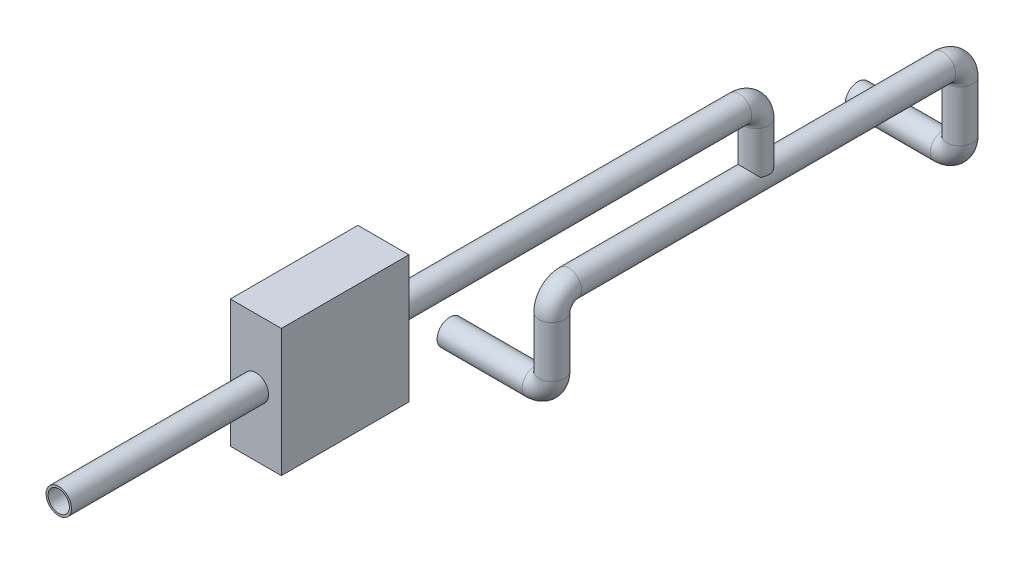
from build123d import *

# Parameters (mm, degrees)
SWEEP1_PROFILE_R     = 7.5
SWEEP2_PROFILE_R     = 7.5
CUT_SWEEP1_PROFILE_R = 6.25
CUT_SWEEP2_PROFILE_R = 6.25
SKETCH35_W           = 75
SKETCH35_H           = 75
BOSS_EXTRUDE1_DEPTH  = 15
BOSS_EXTRUDE2_DEPTH  = 1


with BuildPart() as part:
    # Sweep1: sweep along a curve in space
    with BuildLine() as sweep1_path:
        Line((-10, -50, 120), (-60, -50, 120))
        ThreePointArc((-10, -50, 120), (-2.928932188, -47.071067812, 120), (0, -40, 120))
        Line((0, -10, 120), (0, -40, 120))
        ThreePointArc((0, -10, 120), (0, -2.928932188, 117.071067812), (0, 0, 110))
        Line((0, 0, 0), (0, 0, 110))
        Line((0, 0, 0), (0, 0, -110))
        ThreePointArc((0, -10, -120), (0, -2.928932188, -117.071067812), (0, 0, -110))
        Line((0, -10, -120), (0, -40, -120))
        ThreePointArc((0, -40, -120), (-2.928932188, -47.071067812, -120), (-10, -50, -120))
        Line((-10, -50, -120), (-60, -50, -120))
    # Sweep1 profile (on start of the path) → Sweep1 (sweep)
    with BuildSketch(Plane(origin=(-60, -50, -120), x_dir=(0, 0, 1), z_dir=(1, 0, 0))):
        Circle(SWEEP1_PROFILE_R)
    sweep(path=sweep1_path.line)

    # Sweep2: sweep along a path in Sketch30
    with BuildLine(Plane(origin=(0, 0, 0), x_dir=(0, 0, -1), z_dir=(1, 0, 0))) as sweep2_path:
        Line((0, 3.788993713), (0, 28.788993713))
        ThreePointArc((0, 28.788993713), (-2.928932188, 35.860061525), (-10, 38.788993713))
        Line((-10, 38.788993713), (-410, 38.788993713))
    # Sweep2 profile (on start of the path) → Sweep2 (sweep)
    with BuildSketch(Plane.ZX.offset(3.788993713)):
        Circle(SWEEP2_PROFILE_R)
    sweep(path=sweep2_path.line)

    # Cut-Sweep1: sweep along a curve in space
    with BuildLine() as cut_sweep1_path:
        Line((-10, -50, 120), (-60, -50, 120))
        ThreePointArc((-10, -50, 120), (-2.928932188, -47.071067812, 120), (0, -40, 120))
        Line((0, -10, 120), (0, -40, 120))
        ThreePointArc((0, -10, 120), (0, -2.928932188, 117.071067812), (0, 0, 110))
        Line((0, 0, 0), (0, 0, 110))
        Line((0, 0, 0), (0, 0, -110))
        ThreePointArc((0, -10, -120), (0, -2.928932188, -117.071067812), (0, 0, -110))
        Line((0, -10, -120), (0, -40, -120))
        ThreePointArc((0, -40, -120), (-2.928932188, -47.071067812, -120), (-10, -50, -120))
        Line((-10, -50, -120), (-60, -50, -120))
    # Cut-Sweep1 profile (on start of the path) → Cut-Sweep1 (sweep, cut)
    with BuildSketch(Plane(origin=(-60, -50, -120), x_dir=(0, 0, 1), z_dir=(1, 0, 0))):
        Circle(CUT_SWEEP1_PROFILE_R)
    sweep(path=cut_sweep1_path.line, mode=Mode.SUBTRACT)

    # Cut-Sweep2: sweep along a path in Sketch30<2>
    with BuildLine(Plane(origin=(0, 0, 0), x_dir=(0, 0, -1), z_dir=(1, 0, 0))) as cut_sweep2_path:
        Line((0, 3.788993713), (0, 28.788993713))
        ThreePointArc((0, 28.788993713), (-2.928932188, 35.860061525), (-10, 38.788993713))
        Line((-10, 38.788993713), (-410, 38.788993713))
    # Cut-Sweep2 profile (on start of the path) → Cut-Sweep2 (sweep, cut)
    with BuildSketch(Plane.ZX.offset(3.788993713)):
        Circle(CUT_SWEEP2_PROFILE_R)
    sweep(path=cut_sweep2_path.line, mode=Mode.SUBTRACT)

    # Sketch35 → Boss-Extrude1 (add, symmetric)
    with BuildSketch(Plane(origin=(0, 0, 0), x_dir=(0, 0, -1), z_dir=(1, 0, 0))):
        with Locations((-256.605520268, 38.788993713)):
            Rectangle(SKETCH35_W, SKETCH35_H)
    extrude(amount=BOSS_EXTRUDE1_DEPTH, both=True)

    # Sketch48 → Boss-Extrude2 (add)
    # profile 1 of 23: a face of its own
    with BuildSketch(Plane.ZY.offset(15)):
        with BuildLine():
            Line((226.687251037, 53.697327046), (228.1327071, 53.697327046))
            add(Edge.make_bspline(
                [(228.1327071, 53.697327046), (228.203464046, 53.696955041), (228.340608616, 53.696234003), (228.540039768, 53.685051375), (228.726833084, 53.669803607), (228.901042735, 53.645609911), (229.062588222, 53.616417316), (229.211956388, 53.581065139), (229.348672252, 53.538675473), (229.511894211, 53.471267511), (229.697992943, 53.371100138), (229.899496208, 53.223084675), (230.071801848, 53.042040962), (230.220362886, 52.837819341), (230.338475256, 52.613165291), (230.423923602, 52.373433341), (230.478021104, 52.121715654), (230.483584624, 51.948904261), (230.486396337, 51.861568165)],
                knots=[0, 0, 0, 0, 1.001505555, 1.941167018, 2.826882275, 3.653841531, 4.429895133, 5.150066043, 5.825578002, 6.45369114, 7.647487171, 8.808567382, 9.977351308, 11.170798116, 12.373658725, 13.556498008, 14.765093433, 16, 16, 16, 16], degree=3))
            add(Edge.make_bspline(
                [(230.486396337, 51.861568165), (230.484082358, 51.779753589), (230.47953517, 51.618980231), (230.436052997, 51.383831033), (230.367979582, 51.159990953), (230.273353471, 50.948276904), (230.150370912, 50.753472423), (230.004620805, 50.574006043), (229.828774906, 50.417476306), (229.697026715, 50.329967162), (229.630104603, 50.285516482)],
                knots=[0, 0, 0, 0, 1.044552857, 2.05264487, 3.044412934, 4.028983338, 5.005914585, 5.980388656, 6.974128949, 8, 8, 8, 8], degree=3))
            add(Edge.make_bspline(
                [(229.630104603, 50.285516482), (229.714264175, 50.253205568), (229.875282283, 50.191386785), (230.096867676, 50.082091719), (230.287780098, 49.963215252), (230.449487391, 49.833396169), (230.587785427, 49.693465853), (230.708547487, 49.541372528), (230.811589729, 49.375132157), (230.899882083, 49.196478007), (230.96877695, 49.007234316), (231.020372615, 48.809176173), (231.049937049, 48.603013782), (231.054144223, 48.462709729), (231.056268131, 48.391879997)],
                knots=[0, 0, 0, 0, 1.27268992, 2.434971085, 3.483601985, 4.442670788, 5.356604649, 6.2567628, 7.179492994, 8.113709626, 9.066344395, 10.018646069, 10.999752585, 12, 12, 12, 12], degree=3))
            add(Edge.make_bspline(
                [(231.056268131, 48.391879997), (231.054200474, 48.319560118), (231.0501323, 48.177268729), (231.020118026, 47.968237028), (230.96929875, 47.768476724), (230.899298157, 47.576695754), (230.807937924, 47.393265136), (230.696753733, 47.217977061), (230.56418359, 47.052592728), (230.415883851, 46.895274392), (230.24811231, 46.753822242), (230.067103962, 46.62784733), (229.870579251, 46.524244832), (229.661765864, 46.437215919), (229.438321395, 46.370737349), (229.201249209, 46.324228735), (228.95075377, 46.292891406), (228.778859797, 46.290314989), (228.690706566, 46.288993713)],
                knots=[0, 0, 0, 0, 0.978564426, 1.925352924, 2.850884081, 3.763762016, 4.682927383, 5.618979971, 6.567305752, 7.547517671, 8.540179244, 9.531824382, 10.526200242, 11.540722885, 12.589160233, 13.674978461, 14.80764778, 16, 16, 16, 16], degree=3))
            Line((228.690706566, 46.288993713), (226.687251037, 46.288993713))
            Line((226.687251037, 46.288993713), (226.687251037, 53.697327046))
        make_face()
        with BuildLine():
            Line((227.352101465, 52.937497986), (227.352101465, 50.563032174))
            Line((227.352101465, 50.563032174), (227.798797846, 50.563032174))
            add(Edge.make_bspline(
                [(227.798797846, 50.563032174), (227.864094463, 50.563878678), (227.990260833, 50.565514296), (228.172971281, 50.570199573), (228.342569236, 50.583318765), (228.498761949, 50.596434187), (228.641303456, 50.61775873), (228.769877962, 50.643142057), (228.886503326, 50.66998754), (229.020995364, 50.715642954), (229.173549772, 50.783117366), (229.336179842, 50.887832753), (229.479551136, 51.012555967), (229.600618517, 51.156470169), (229.699702796, 51.314936929), (229.768523493, 51.485427826), (229.815190245, 51.663693772), (229.819405653, 51.786075741), (229.821545909, 51.848211795)],
                knots=[0, 0, 0, 0, 1.156816544, 2.235205308, 3.236616184, 4.169592532, 5.011045266, 5.787822928, 6.49130361, 7.128639758, 8.301311294, 9.436451833, 10.541879658, 11.654887649, 12.756523258, 13.837046038, 14.901820046, 16, 16, 16, 16], degree=3))
            add(Edge.make_bspline(
                [(229.821545909, 51.848211795), (229.820432161, 51.889329678), (229.818247423, 51.969986896), (229.800354599, 52.087566362), (229.769943233, 52.198148971), (229.730881646, 52.303250172), (229.676295588, 52.399583588), (229.612026257, 52.490480019), (229.534374879, 52.572844003), (229.445988568, 52.649826108), (229.344370316, 52.718077025), (229.229580748, 52.777853307), (229.100066832, 52.825987951), (228.958011289, 52.868143807), (228.801227487, 52.897752362), (228.631524682, 52.922418699), (228.44751286, 52.934976337), (228.320205727, 52.936638688), (228.254398473, 52.937497986)],
                knots=[0, 0, 0, 0, 0.91205012, 1.789085906, 2.630437955, 3.453916878, 4.269457761, 5.079663411, 5.91843418, 6.774407191, 7.675494373, 8.627863946, 9.638891023, 10.736472738, 11.911756761, 13.175263542, 14.539845004, 16, 16, 16, 16], degree=3))
            Line((228.254398473, 52.937497986), (227.352101465, 52.937497986))
        make_face(mode=Mode.SUBTRACT)
        with BuildLine():
            Line((227.352101465, 49.803203114), (227.352101465, 47.048822773))
            Line((227.352101465, 47.048822773), (228.298919707, 47.048822773))
            add(Edge.make_bspline(
                [(228.298919707, 47.048822773), (228.3666931, 47.049635038), (228.497317381, 47.051200572), (228.685914985, 47.056311379), (228.860715888, 47.067936696), (229.020922442, 47.086237078), (229.168264567, 47.106088129), (229.300974705, 47.132782007), (229.420128631, 47.16336564), (229.558292582, 47.210639638), (229.713875008, 47.284080501), (229.881537987, 47.39481228), (230.030606816, 47.526729949), (230.157194615, 47.67940705), (230.260938774, 47.845420026), (230.336409487, 48.021411016), (230.3829568, 48.204472049), (230.388591725, 48.329284924), (230.391417704, 48.391879997)],
                knots=[0, 0, 0, 0, 1.160039823, 2.235823828, 3.228722157, 4.157150951, 4.99529583, 5.772374946, 6.472645482, 7.099169577, 8.269452708, 9.405989375, 10.527446681, 11.663510218, 12.788923519, 13.866172445, 14.929861265, 16, 16, 16, 16], degree=3))
            add(Edge.make_bspline(
                [(230.391417704, 48.391879997), (230.390833283, 48.431024235), (230.389673868, 48.50868131), (230.3721889, 48.622803127), (230.346759542, 48.733347892), (230.313884674, 48.840615776), (230.266006802, 48.942667423), (230.210112948, 49.041521174), (230.144577981, 49.137307705), (230.042461164, 49.258406975), (229.893930463, 49.397931319), (229.682884455, 49.534535699), (229.442913091, 49.644703557), (229.268864898, 49.691480782), (229.178956099, 49.715644688)],
                knots=[0, 0, 0, 0, 0.723448775, 1.435228256, 2.130040452, 2.821711965, 3.505591119, 4.210454504, 4.921174351, 5.648778258, 7.137944449, 8.670945889, 10.280296675, 12, 12, 12, 12], degree=3))
            add(Edge.make_bspline(
                [(229.178956099, 49.715644688), (229.142911179, 49.722957949), (229.064758359, 49.738814607), (228.93731898, 49.755552579), (228.791828058, 49.770464623), (228.627949634, 49.781494906), (228.445476371, 49.792896424), (228.244018559, 49.797330462), (228.02439891, 49.802620562), (227.872015055, 49.803003963), (227.792861681, 49.803203114)],
                knots=[0, 0, 0, 0, 0.634451884, 1.375622551, 2.216452059, 3.157844607, 4.20941857, 5.370758133, 6.634282058, 8, 8, 8, 8], degree=3))
            Line((227.792861681, 49.803203114), (227.352101465, 49.803203114))
        make_face(mode=Mode.SUBTRACT)
    # profile 2 of 23: a face of its own
    with BuildSketch(Plane.ZY.offset(15)):
        with BuildLine():
            Line((232.575926251, 53.697327046), (233.240776678, 53.697327046))
            Line((233.240776678, 53.697327046), (233.240776678, 49.258560019))
            add(Edge.make_bspline(
                [(233.240776678, 49.258560019), (233.240677737, 49.195735795), (233.240489979, 49.076516003), (233.241744133, 48.906826434), (233.245256463, 48.755966395), (233.247470834, 48.623354376), (233.252397023, 48.509598894), (233.256414556, 48.414083653), (233.261580401, 48.337260925), (233.267788833, 48.292427965), (233.270457501, 48.273156707)],
                knots=[0, 0, 0, 0, 1.528628734, 2.90083645, 4.128790002, 5.200304208, 6.127813768, 6.898992206, 7.526736466, 8, 8, 8, 8], degree=3))
            add(Edge.make_bspline(
                [(233.270457501, 48.273156707), (233.281416456, 48.203631058), (233.302716867, 48.068497281), (233.3570017, 47.876074751), (233.43281541, 47.702653164), (233.522653184, 47.542820932), (233.641043878, 47.401026786), (233.782868028, 47.270403788), (233.954694304, 47.156163468), (234.14574592, 47.05170425), (234.351666339, 46.967746492), (234.562086853, 46.904260537), (234.773844492, 46.8655702), (234.915610708, 46.861090192), (234.98600905, 46.858865508)],
                knots=[0, 0, 0, 0, 1.035780045, 2.013197591, 2.933192213, 3.817615948, 4.702609284, 5.640816605, 6.646850145, 7.73207398, 8.84249596, 9.914020372, 10.964143139, 12, 12, 12, 12], degree=3))
            add(Edge.make_bspline(
                [(234.98600905, 46.858865508), (235.046447801, 46.861138491), (235.166976223, 46.865671329), (235.346059835, 46.893741358), (235.520473398, 46.944330888), (235.691078171, 47.009608377), (235.850994421, 47.095857445), (236.000311373, 47.195490722), (236.133585034, 47.312353743), (236.255204463, 47.441682805), (236.361111744, 47.587605382), (236.452913994, 47.746944107), (236.528110545, 47.922096892), (236.565244339, 48.045190419), (236.58432135, 48.108428141)],
                knots=[0, 0, 0, 0, 0.994687771, 1.983630487, 2.973142513, 3.978332533, 4.983357753, 5.956394766, 6.925816176, 7.893390482, 8.871859704, 9.88551698, 10.913711441, 12, 12, 12, 12], degree=3))
            add(Edge.make_bspline(
                [(236.58432135, 48.108428141), (236.590671615, 48.134565957), (236.604822565, 48.192811544), (236.618045477, 48.291281609), (236.631817622, 48.407464096), (236.641373462, 48.542193766), (236.650689379, 48.695019158), (236.656262716, 48.866736403), (236.658838769, 49.05672197), (236.659606443, 49.189303963), (236.660007448, 49.258560019)],
                knots=[0, 0, 0, 0, 0.558680831, 1.244966039, 2.062412453, 2.990489873, 4.051219941, 5.244515665, 6.560634259, 8, 8, 8, 8], degree=3))
            Line((236.660007448, 49.258560019), (236.660007448, 53.697327046))
            Line((236.660007448, 53.697327046), (237.324857875, 53.697327046))
            Line((237.324857875, 53.697327046), (237.324857875, 49.222943032))
            add(Edge.make_bspline(
                [(237.324857875, 49.222943032), (237.324319987, 49.142301463), (237.323270265, 48.984924538), (237.314167379, 48.754310828), (237.299653396, 48.535547018), (237.279146943, 48.3286037), (237.251975286, 48.134221397), (237.221759403, 47.950696304), (237.183279391, 47.779345803), (237.138335358, 47.618833852), (237.086956348, 47.466041182), (237.020405918, 47.321031281), (236.94542406, 47.179395802), (236.856493044, 47.043276971), (236.756562284, 46.912072101), (236.643422893, 46.786576892), (236.520816753, 46.664785911), (236.386705685, 46.549823254), (236.243300407, 46.444394888), (236.091027496, 46.351689606), (235.931056667, 46.273322949), (235.76380375, 46.208815575), (235.58919737, 46.160313007), (235.407233126, 46.124170594), (235.217496833, 46.103634064), (235.088454978, 46.100581979), (235.023110079, 46.099036448)],
                knots=[0, 0, 0, 0, 1.316592851, 2.569410997, 3.76748051, 4.895814652, 5.963796859, 6.97159953, 7.931736103, 8.829262218, 9.692595152, 10.560224239, 11.431080259, 12.30701507, 13.211635791, 14.121146779, 15.063487852, 16.031507147, 17.00238618, 17.966455255, 18.938106653, 19.907068911, 20.888905087, 21.893141452, 22.933117798, 24, 24, 24, 24], degree=3))
            add(Edge.make_bspline(
                [(235.023110079, 46.099036448), (234.951843811, 46.100697534), (234.81201965, 46.10395658), (234.605987408, 46.122631401), (234.408472359, 46.157807002), (234.217388419, 46.20259555), (234.0353371, 46.264367794), (233.85987931, 46.336542158), (233.694020101, 46.425182359), (233.535068746, 46.523805041), (233.387273012, 46.634770525), (233.251600175, 46.755717227), (233.127826249, 46.884707692), (233.018037509, 47.023138466), (232.920414969, 47.169932913), (232.836319351, 47.325506304), (232.764112984, 47.489798406), (232.726845751, 47.603999347), (232.708005912, 47.66173176)],
                knots=[0, 0, 0, 0, 1.13879206, 2.234305948, 3.301075583, 4.341971843, 5.366689343, 6.369221514, 7.369726634, 8.367512178, 9.355451585, 10.318319045, 11.268648973, 12.207971039, 13.137398894, 14.081662264, 15.030215811, 16, 16, 16, 16], degree=3))
            add(Edge.make_bspline(
                [(232.708005912, 47.66173176), (232.697047594, 47.701170709), (232.673278758, 47.786714669), (232.647825211, 47.928291069), (232.626427655, 48.091305979), (232.606307557, 48.275770554), (232.594435262, 48.481827772), (232.584026684, 48.70938831), (232.575852924, 48.958727329), (232.575901125, 49.132409387), (232.575926251, 49.222943032)],
                knots=[0, 0, 0, 0, 0.625038921, 1.35572334, 2.194682327, 3.136881307, 4.189498639, 5.346923369, 6.617055217, 8, 8, 8, 8], degree=3))
            Line((232.575926251, 49.222943032), (232.575926251, 53.697327046))
        make_face()
    # profile 3 of 23: a face of its own
    with BuildSketch(Plane.ZY.offset(15)):
        with BuildLine():
            Line((239.224430525, 53.697327046), (240.669886588, 53.697327046))
            add(Edge.make_bspline(
                [(240.669886588, 53.697327046), (240.740643533, 53.696955041), (240.877788103, 53.696234003), (241.077219255, 53.685051375), (241.264012571, 53.669803607), (241.438222223, 53.645609911), (241.599767709, 53.616417316), (241.749135875, 53.581065139), (241.885851739, 53.538675473), (242.049073698, 53.471267511), (242.23517243, 53.371100138), (242.436675695, 53.223084675), (242.608981335, 53.042040962), (242.757542373, 52.837819341), (242.875654743, 52.613165291), (242.961103089, 52.373433341), (243.015200592, 52.121715654), (243.020764111, 51.948904261), (243.023575824, 51.861568165)],
                knots=[0, 0, 0, 0, 1.001505555, 1.941167018, 2.826882275, 3.653841531, 4.429895133, 5.150066043, 5.825578002, 6.45369114, 7.647487171, 8.808567382, 9.977351308, 11.170798116, 12.373658725, 13.556498008, 14.765093433, 16, 16, 16, 16], degree=3))
            add(Edge.make_bspline(
                [(243.023575824, 51.861568165), (243.021261845, 51.779753589), (243.016714658, 51.618980231), (242.973232484, 51.383831033), (242.905159069, 51.159990953), (242.810532958, 50.948276904), (242.6875504, 50.753472423), (242.541800292, 50.574006043), (242.365954393, 50.417476306), (242.234206202, 50.329967162), (242.16728409, 50.285516482)],
                knots=[0, 0, 0, 0, 1.044552857, 2.05264487, 3.044412934, 4.028983338, 5.005914585, 5.980388656, 6.974128949, 8, 8, 8, 8], degree=3))
            add(Edge.make_bspline(
                [(242.16728409, 50.285516482), (242.251443662, 50.253205568), (242.412461771, 50.191386785), (242.634047164, 50.082091719), (242.824959586, 49.963215252), (242.986666878, 49.833396169), (243.124964914, 49.693465853), (243.245726974, 49.541372528), (243.348769216, 49.375132157), (243.437061571, 49.196478007), (243.505956438, 49.007234316), (243.557552102, 48.809176173), (243.587116536, 48.603013782), (243.59132371, 48.462709729), (243.593447619, 48.391879997)],
                knots=[0, 0, 0, 0, 1.27268992, 2.434971085, 3.483601985, 4.442670788, 5.356604649, 6.2567628, 7.179492994, 8.113709626, 9.066344395, 10.018646069, 10.999752585, 12, 12, 12, 12], degree=3))
            add(Edge.make_bspline(
                [(243.593447619, 48.391879997), (243.591379961, 48.319560118), (243.587311787, 48.177268729), (243.557297514, 47.968237028), (243.506478237, 47.768476724), (243.436477644, 47.576695754), (243.345117411, 47.393265136), (243.23393322, 47.217977061), (243.101363077, 47.052592728), (242.953063338, 46.895274392), (242.785291797, 46.753822242), (242.604283449, 46.62784733), (242.407758738, 46.524244832), (242.198945351, 46.437215919), (241.975500882, 46.370737349), (241.738428696, 46.324228735), (241.487933257, 46.292891406), (241.316039284, 46.290314989), (241.227886053, 46.288993713)],
                knots=[0, 0, 0, 0, 0.978564426, 1.925352924, 2.850884081, 3.763762016, 4.682927383, 5.618979971, 6.567305752, 7.547517671, 8.540179244, 9.531824382, 10.526200242, 11.540722885, 12.589160233, 13.674978461, 14.80764778, 16, 16, 16, 16], degree=3))
            Line((241.227886053, 46.288993713), (239.224430525, 46.288993713))
            Line((239.224430525, 46.288993713), (239.224430525, 53.697327046))
        make_face()
        with BuildLine():
            Line((239.889280952, 52.937497986), (239.889280952, 50.563032174))
            Line((239.889280952, 50.563032174), (240.335977333, 50.563032174))
            add(Edge.make_bspline(
                [(240.335977333, 50.563032174), (240.40127395, 50.563878678), (240.52744032, 50.565514296), (240.710150768, 50.570199573), (240.879748723, 50.583318765), (241.035941436, 50.596434187), (241.178482943, 50.61775873), (241.30705745, 50.643142057), (241.423682813, 50.66998754), (241.558174851, 50.715642954), (241.710729259, 50.783117366), (241.873359329, 50.887832753), (242.016730623, 51.012555967), (242.137798004, 51.156470169), (242.236882283, 51.314936929), (242.30570298, 51.485427826), (242.352369732, 51.663693772), (242.35658514, 51.786075741), (242.358725396, 51.848211795)],
                knots=[0, 0, 0, 0, 1.156816544, 2.235205308, 3.236616184, 4.169592532, 5.011045266, 5.787822928, 6.49130361, 7.128639758, 8.301311294, 9.436451833, 10.541879658, 11.654887649, 12.756523258, 13.837046038, 14.901820046, 16, 16, 16, 16], degree=3))
            add(Edge.make_bspline(
                [(242.358725396, 51.848211795), (242.357611648, 51.889329678), (242.35542691, 51.969986896), (242.337534086, 52.087566362), (242.30712272, 52.198148971), (242.268061133, 52.303250172), (242.213475075, 52.399583588), (242.149205744, 52.490480019), (242.071554367, 52.572844003), (241.983168055, 52.649826108), (241.881549803, 52.718077025), (241.766760235, 52.777853307), (241.637246319, 52.825987951), (241.495190776, 52.868143807), (241.338406974, 52.897752362), (241.168704169, 52.922418699), (240.984692347, 52.934976337), (240.857385214, 52.936638688), (240.79157796, 52.937497986)],
                knots=[0, 0, 0, 0, 0.91205012, 1.789085906, 2.630437955, 3.453916878, 4.269457761, 5.079663411, 5.91843418, 6.774407191, 7.675494373, 8.627863946, 9.638891023, 10.736472738, 11.911756761, 13.175263542, 14.539845004, 16, 16, 16, 16], degree=3))
            Line((240.79157796, 52.937497986), (239.889280952, 52.937497986))
        make_face(mode=Mode.SUBTRACT)
        with BuildLine():
            Line((239.889280952, 49.803203114), (239.889280952, 47.048822773))
            Line((239.889280952, 47.048822773), (240.836099194, 47.048822773))
            add(Edge.make_bspline(
                [(240.836099194, 47.048822773), (240.903872588, 47.049635038), (241.034496868, 47.051200572), (241.223094472, 47.056311379), (241.397895375, 47.067936696), (241.558101929, 47.086237078), (241.705444054, 47.106088129), (241.838154192, 47.132782007), (241.957308118, 47.16336564), (242.095472069, 47.210639638), (242.251054495, 47.284080501), (242.418717475, 47.39481228), (242.567786303, 47.526729949), (242.694374102, 47.67940705), (242.798118261, 47.845420026), (242.873588974, 48.021411016), (242.920136287, 48.204472049), (242.925771212, 48.329284924), (242.928597191, 48.391879997)],
                knots=[0, 0, 0, 0, 1.160039823, 2.235823828, 3.228722157, 4.157150951, 4.99529583, 5.772374946, 6.472645482, 7.099169577, 8.269452708, 9.405989375, 10.527446681, 11.663510218, 12.788923519, 13.866172445, 14.929861265, 16, 16, 16, 16], degree=3))
            add(Edge.make_bspline(
                [(242.928597191, 48.391879997), (242.92801277, 48.431024235), (242.926853355, 48.50868131), (242.909368387, 48.622803127), (242.883939029, 48.733347892), (242.851064161, 48.840615776), (242.803186289, 48.942667423), (242.747292435, 49.041521174), (242.681757469, 49.137307705), (242.579640651, 49.258406975), (242.43110995, 49.397931319), (242.220063942, 49.534535699), (241.980092578, 49.644703557), (241.806044385, 49.691480782), (241.716135586, 49.715644688)],
                knots=[0, 0, 0, 0, 0.723448775, 1.435228256, 2.130040452, 2.821711965, 3.505591119, 4.210454504, 4.921174351, 5.648778258, 7.137944449, 8.670945889, 10.280296675, 12, 12, 12, 12], degree=3))
            add(Edge.make_bspline(
                [(241.716135586, 49.715644688), (241.680090666, 49.722957949), (241.601937846, 49.738814607), (241.474498467, 49.755552579), (241.329007545, 49.770464623), (241.165129121, 49.781494906), (240.982655858, 49.792896424), (240.781198047, 49.797330462), (240.561578397, 49.802620562), (240.409194542, 49.803003963), (240.330041168, 49.803203114)],
                knots=[0, 0, 0, 0, 0.634451884, 1.375622551, 2.216452059, 3.157844607, 4.20941857, 5.370758133, 6.634282058, 8, 8, 8, 8], degree=3))
            Line((240.330041168, 49.803203114), (239.889280952, 49.803203114))
        make_face(mode=Mode.SUBTRACT)
    # profile 4 of 23: a face of its own
    with BuildSketch(Plane.ZY.offset(15)):
        with BuildLine():
            Line((245.113105738, 53.697327046), (246.558561801, 53.697327046))
            add(Edge.make_bspline(
                [(246.558561801, 53.697327046), (246.629318747, 53.696955041), (246.766463317, 53.696234003), (246.965894469, 53.685051375), (247.152687785, 53.669803607), (247.326897436, 53.645609911), (247.488442923, 53.616417316), (247.637811088, 53.581065139), (247.774526953, 53.538675473), (247.937748912, 53.471267511), (248.123847644, 53.371100138), (248.325350909, 53.223084675), (248.497656549, 53.042040962), (248.646217587, 52.837819341), (248.764329957, 52.613165291), (248.849778303, 52.373433341), (248.903875805, 52.121715654), (248.909439324, 51.948904261), (248.912251037, 51.861568165)],
                knots=[0, 0, 0, 0, 1.001505555, 1.941167018, 2.826882275, 3.653841531, 4.429895133, 5.150066043, 5.825578002, 6.45369114, 7.647487171, 8.808567382, 9.977351308, 11.170798116, 12.373658725, 13.556498008, 14.765093433, 16, 16, 16, 16], degree=3))
            add(Edge.make_bspline(
                [(248.912251037, 51.861568165), (248.909937058, 51.779753589), (248.905389871, 51.618980231), (248.861907697, 51.383831033), (248.793834283, 51.159990953), (248.699208172, 50.948276904), (248.576225613, 50.753472423), (248.430475505, 50.574006043), (248.254629607, 50.417476306), (248.122881415, 50.329967162), (248.055959304, 50.285516482)],
                knots=[0, 0, 0, 0, 1.044552857, 2.05264487, 3.044412934, 4.028983338, 5.005914585, 5.980388656, 6.974128949, 8, 8, 8, 8], degree=3))
            add(Edge.make_bspline(
                [(248.055959304, 50.285516482), (248.140118876, 50.253205568), (248.301136984, 50.191386785), (248.522722377, 50.082091719), (248.713634799, 49.963215252), (248.875342092, 49.833396169), (249.013640128, 49.693465853), (249.134402187, 49.541372528), (249.237444429, 49.375132157), (249.325736784, 49.196478007), (249.394631651, 49.007234316), (249.446227315, 48.809176173), (249.475791749, 48.603013782), (249.479998924, 48.462709729), (249.482122832, 48.391879997)],
                knots=[0, 0, 0, 0, 1.27268992, 2.434971085, 3.483601985, 4.442670788, 5.356604649, 6.2567628, 7.179492994, 8.113709626, 9.066344395, 10.018646069, 10.999752585, 12, 12, 12, 12], degree=3))
            add(Edge.make_bspline(
                [(249.482122832, 48.391879997), (249.480055175, 48.319560118), (249.475987001, 48.177268729), (249.445972727, 47.968237028), (249.395153451, 47.768476724), (249.325152858, 47.576695754), (249.233792625, 47.393265136), (249.122608434, 47.217977061), (248.990038291, 47.052592728), (248.841738552, 46.895274392), (248.67396701, 46.753822242), (248.492958663, 46.62784733), (248.296433952, 46.524244832), (248.087620565, 46.437215919), (247.864176096, 46.370737349), (247.62710391, 46.324228735), (247.376608471, 46.292891406), (247.204714498, 46.290314989), (247.116561267, 46.288993713)],
                knots=[0, 0, 0, 0, 0.978564426, 1.925352924, 2.850884081, 3.763762016, 4.682927383, 5.618979971, 6.567305752, 7.547517671, 8.540179244, 9.531824382, 10.526200242, 11.540722885, 12.589160233, 13.674978461, 14.80764778, 16, 16, 16, 16], degree=3))
            Line((247.116561267, 46.288993713), (245.113105738, 46.288993713))
            Line((245.113105738, 46.288993713), (245.113105738, 53.697327046))
        make_face()
        with BuildLine():
            Line((245.777956166, 52.937497986), (245.777956166, 50.563032174))
            Line((245.777956166, 50.563032174), (246.224652546, 50.563032174))
            add(Edge.make_bspline(
                [(246.224652546, 50.563032174), (246.289949163, 50.563878678), (246.416115534, 50.565514296), (246.598825981, 50.570199573), (246.768423937, 50.583318765), (246.92461665, 50.596434187), (247.067158156, 50.61775873), (247.195732663, 50.643142057), (247.312358027, 50.66998754), (247.446850065, 50.715642954), (247.599404472, 50.783117366), (247.762034543, 50.887832753), (247.905405837, 51.012555967), (248.026473217, 51.156470169), (248.125557497, 51.314936929), (248.194378194, 51.485427826), (248.241044945, 51.663693772), (248.245260353, 51.786075741), (248.24740061, 51.848211795)],
                knots=[0, 0, 0, 0, 1.156816544, 2.235205308, 3.236616184, 4.169592532, 5.011045266, 5.787822928, 6.49130361, 7.128639758, 8.301311294, 9.436451833, 10.541879658, 11.654887649, 12.756523258, 13.837046038, 14.901820046, 16, 16, 16, 16], degree=3))
            add(Edge.make_bspline(
                [(248.24740061, 51.848211795), (248.246286862, 51.889329678), (248.244102124, 51.969986896), (248.2262093, 52.087566362), (248.195797934, 52.198148971), (248.156736346, 52.303250172), (248.102150289, 52.399583588), (248.037880958, 52.490480019), (247.96022958, 52.572844003), (247.871843268, 52.649826108), (247.770225017, 52.718077025), (247.655435449, 52.777853307), (247.525921533, 52.825987951), (247.38386599, 52.868143807), (247.227082188, 52.897752362), (247.057379383, 52.922418699), (246.873367561, 52.934976337), (246.746060427, 52.936638688), (246.680253174, 52.937497986)],
                knots=[0, 0, 0, 0, 0.91205012, 1.789085906, 2.630437955, 3.453916878, 4.269457761, 5.079663411, 5.91843418, 6.774407191, 7.675494373, 8.627863946, 9.638891023, 10.736472738, 11.911756761, 13.175263542, 14.539845004, 16, 16, 16, 16], degree=3))
            Line((246.680253174, 52.937497986), (245.777956166, 52.937497986))
        make_face(mode=Mode.SUBTRACT)
        with BuildLine():
            Line((245.777956166, 49.803203114), (245.777956166, 47.048822773))
            Line((245.777956166, 47.048822773), (246.724774408, 47.048822773))
            add(Edge.make_bspline(
                [(246.724774408, 47.048822773), (246.792547801, 47.049635038), (246.923172082, 47.051200572), (247.111769686, 47.056311379), (247.286570589, 47.067936696), (247.446777143, 47.086237078), (247.594119267, 47.106088129), (247.726829406, 47.132782007), (247.845983332, 47.16336564), (247.984147283, 47.210639638), (248.139729709, 47.284080501), (248.307392688, 47.39481228), (248.456461517, 47.526729949), (248.583049315, 47.67940705), (248.686793474, 47.845420026), (248.762264188, 48.021411016), (248.808811501, 48.204472049), (248.814446426, 48.329284924), (248.817272405, 48.391879997)],
                knots=[0, 0, 0, 0, 1.160039823, 2.235823828, 3.228722157, 4.157150951, 4.99529583, 5.772374946, 6.472645482, 7.099169577, 8.269452708, 9.405989375, 10.527446681, 11.663510218, 12.788923519, 13.866172445, 14.929861265, 16, 16, 16, 16], degree=3))
            add(Edge.make_bspline(
                [(248.817272405, 48.391879997), (248.816687984, 48.431024235), (248.815528569, 48.50868131), (248.798043601, 48.622803127), (248.772614243, 48.733347892), (248.739739375, 48.840615776), (248.691861503, 48.942667423), (248.635967649, 49.041521174), (248.570432682, 49.137307705), (248.468315865, 49.258406975), (248.319785164, 49.397931319), (248.108739156, 49.534535699), (247.868767792, 49.644703557), (247.694719599, 49.691480782), (247.6048108, 49.715644688)],
                knots=[0, 0, 0, 0, 0.723448775, 1.435228256, 2.130040452, 2.821711965, 3.505591119, 4.210454504, 4.921174351, 5.648778258, 7.137944449, 8.670945889, 10.280296675, 12, 12, 12, 12], degree=3))
            add(Edge.make_bspline(
                [(247.6048108, 49.715644688), (247.56876588, 49.722957949), (247.49061306, 49.738814607), (247.363173681, 49.755552579), (247.217682759, 49.770464623), (247.053804335, 49.781494906), (246.871331071, 49.792896424), (246.66987326, 49.797330462), (246.450253611, 49.802620562), (246.297869756, 49.803003963), (246.218716382, 49.803203114)],
                knots=[0, 0, 0, 0, 0.634451884, 1.375622551, 2.216452059, 3.157844607, 4.20941857, 5.370758133, 6.634282058, 8, 8, 8, 8], degree=3))
            Line((246.218716382, 49.803203114), (245.777956166, 49.803203114))
        make_face(mode=Mode.SUBTRACT)
    # profile 5 of 23: a face of its own
    with BuildSketch(Plane.ZY.offset(15)):
        Polygon((251.001780952, 53.697327046), (251.666631379, 53.697327046), (251.666631379, 47.048822773), (254.515990354, 47.048822773), (254.515990354, 46.288993713), (251.001780952, 46.288993713), align=None)
    # profile 6 of 23: a face of its own
    with BuildSketch(Plane.ZY.offset(15)):
        Polygon((255.750712576, 53.697327046), (259.929772405, 53.697327046), (259.929772405, 52.937497986), (256.415563003, 52.937497986), (256.415563003, 50.658010807), (259.929772405, 50.658010807), (259.929772405, 49.898181747), (256.415563003, 49.898181747), (256.415563003, 47.048822773), (259.929772405, 47.048822773), (259.929772405, 46.288993713), (255.750712576, 46.288993713), align=None)
    # profile 7 of 23: a face of its own
    with BuildSketch(Plane.ZY.offset(15)):
        Polygon((263.254024542, 52.937497986), (263.254024542, 53.697327046), (267.148148473, 53.697327046), (267.148148473, 52.937497986), (265.533511721, 52.937497986), (265.533511721, 46.288993713), (264.868661294, 46.288993713), (264.868661294, 52.937497986), align=None)
    # profile 8 of 23: a face of its own
    with BuildSketch(Plane.ZY.offset(15)):
        with BuildLine():
            Line((268.287892063, 53.697327046), (269.770449154, 53.697327046))
            add(Edge.make_bspline(
                [(269.770449154, 53.697327046), (269.869384543, 53.696997722), (270.059351449, 53.696365384), (270.331498204, 53.69283952), (270.578782226, 53.6827338), (270.80107422, 53.674037298), (270.998370106, 53.658179356), (271.171274871, 53.643022653), (271.318992164, 53.623181737), (271.40841255, 53.604755259), (271.448899675, 53.596412249)],
                knots=[0, 0, 0, 0, 1.410062039, 2.707475311, 3.878576406, 4.937260626, 5.877586885, 6.699081471, 7.410979367, 8, 8, 8, 8], degree=3))
            add(Edge.make_bspline(
                [(271.448899675, 53.596412249), (271.503100363, 53.583020596), (271.610345491, 53.556522969), (271.764756464, 53.500516814), (271.911895116, 53.435705275), (272.051150244, 53.359582067), (272.181824336, 53.271582117), (272.30526476, 53.173224591), (272.422031658, 53.065047672), (272.527402775, 52.944323925), (272.626757101, 52.817669979), (272.710553027, 52.680713694), (272.782787409, 52.537496794), (272.840298337, 52.38656276), (272.886606714, 52.229375342), (272.919258921, 52.064510723), (272.938840601, 51.892719992), (272.940834195, 51.775545752), (272.941845055, 51.716132134)],
                knots=[0, 0, 0, 0, 1.027469482, 2.033020251, 3.019912614, 3.986113645, 4.951240523, 5.91722682, 6.890402269, 7.87763091, 8.8651537, 9.85103654, 10.82876324, 11.815024772, 12.821070561, 13.842952187, 14.906261191, 16, 16, 16, 16], degree=3))
            add(Edge.make_bspline(
                [(272.941845055, 51.716132134), (272.938735675, 51.617421163), (272.932668471, 51.424810491), (272.876100335, 51.145281625), (272.783440035, 50.884530909), (272.655755739, 50.642886659), (272.493154516, 50.425059126), (272.297733708, 50.233732662), (272.069384297, 50.073628181), (271.856808912, 49.962603077), (271.669030522, 49.891498088), (271.514443344, 49.841467795), (271.345814908, 49.802813301), (271.164760883, 49.768184356), (270.970527812, 49.742039936), (270.763581229, 49.722891311), (270.543773541, 49.710923575), (270.392772511, 49.709141331), (270.31509225, 49.708224482)],
                knots=[0, 0, 0, 0, 1.260483769, 2.459530307, 3.627416485, 4.787058657, 5.939039949, 7.08810263, 8.267026773, 9.491475466, 10.141966685, 10.831826277, 11.566392101, 12.351337768, 13.187381173, 14.07005841, 15.007169909, 16, 16, 16, 16], degree=3))
            Line((270.31509225, 49.708224482), (273.036823687, 46.288993713))
            Line((273.036823687, 46.288993713), (272.2146649, 46.288993713))
            Line((272.2146649, 46.288993713), (269.492933463, 49.708224482))
            Line((269.492933463, 49.708224482), (268.95274249, 49.708224482))
            Line((268.95274249, 49.708224482), (268.95274249, 46.288993713))
            Line((268.95274249, 46.288993713), (268.287892063, 46.288993713))
            Line((268.287892063, 46.288993713), (268.287892063, 53.697327046))
        make_face()
        with BuildLine():
            Line((268.95274249, 52.937497986), (268.95274249, 50.468053542))
            Line((268.95274249, 50.468053542), (270.309156085, 50.457665254))
            add(Edge.make_bspline(
                [(270.309156085, 50.457665254), (270.372486835, 50.457637236), (270.495239864, 50.45758293), (270.672829604, 50.466036423), (270.838183841, 50.475653114), (270.990670099, 50.490362562), (271.130356501, 50.50931958), (271.257173225, 50.533032563), (271.371327285, 50.560659429), (271.504462525, 50.603419537), (271.653129849, 50.671165609), (271.814698106, 50.769729248), (271.952286388, 50.89370055), (272.068529196, 51.035461032), (272.161936493, 51.191324426), (272.227790341, 51.359422407), (272.269578511, 51.53551129), (272.274507265, 51.656538285), (272.276994627, 51.717616175)],
                knots=[0, 0, 0, 0, 1.146690395, 2.22261258, 3.21895312, 4.145990853, 4.996080663, 5.770904154, 6.481378293, 7.121626537, 8.300444488, 9.431385265, 10.535395872, 11.636531494, 12.74115979, 13.810798291, 14.895190096, 16, 16, 16, 16], degree=3))
            add(Edge.make_bspline(
                [(272.276994627, 51.717616175), (272.274450138, 51.77719309), (272.269407888, 51.895252795), (272.228241327, 52.068091138), (272.15862547, 52.231216183), (272.064810067, 52.383964343), (271.950511855, 52.52261815), (271.816489152, 52.641251291), (271.666406489, 52.739145991), (271.526132452, 52.801702763), (271.400753369, 52.840056453), (271.291893922, 52.867046416), (271.168891294, 52.888730542), (271.03114824, 52.906104271), (270.879252788, 52.921037236), (270.71243691, 52.931095168), (270.531807392, 52.93705118), (270.406613054, 52.937345585), (270.34180499, 52.937497986)],
                knots=[0, 0, 0, 0, 1.101028733, 2.181837193, 3.264309656, 4.369019818, 5.486613113, 6.575447106, 7.666700264, 8.788928104, 9.402425223, 10.0903467, 10.862060571, 11.710948788, 12.657782767, 13.684531032, 14.801375019, 16, 16, 16, 16], degree=3))
            Line((270.34180499, 52.937497986), (268.95274249, 52.937497986))
        make_face(mode=Mode.SUBTRACT)
    # profile 9 of 23: a face of its own
    with BuildSketch(Plane.ZY.offset(15)):
        Polygon((277.595798046, 53.697327046), (281.015028815, 46.288993713), (280.292300784, 46.288993713), (279.197078428, 48.663459525), (275.838693345, 48.663459525), (274.712306126, 46.288993713), (273.986610012, 46.288993713), (277.500819413, 53.697327046), align=None)
        Polygon((277.540888524, 52.253355024), (276.19931534, 49.423288584), (278.846844721, 49.423288584), align=None, mode=Mode.SUBTRACT)
    # profile 10 of 23: a face of its own
    with BuildSketch(Plane.ZY.offset(15)):
        with BuildLine():
            Line((282.34472967, 53.697327046), (283.797605939, 53.697327046))
            add(Edge.make_bspline(
                [(283.797605939, 53.697327046), (283.89753569, 53.697217199), (284.089005531, 53.697006727), (284.363569066, 53.690625515), (284.612932998, 53.68210235), (284.836559638, 53.670287343), (285.035137045, 53.65632456), (285.207766663, 53.636741077), (285.35580539, 53.616293451), (285.444507375, 53.595504808), (285.484960706, 53.586023961)],
                knots=[0, 0, 0, 0, 1.415646017, 2.712440637, 3.8905458, 4.950247383, 5.884950622, 6.709939814, 7.411656543, 8, 8, 8, 8], degree=3))
            add(Edge.make_bspline(
                [(285.484960706, 53.586023961), (285.536170353, 53.572007501), (285.637382954, 53.54430486), (285.783223496, 53.488819145), (285.921979135, 53.423028562), (286.054125934, 53.34804789), (286.17804001, 53.260660112), (286.29557013, 53.164407621), (286.405679088, 53.057068134), (286.507747701, 52.939845568), (286.601483856, 52.814707791), (286.682191684, 52.679786738), (286.749770982, 52.537353479), (286.80773224, 52.387507086), (286.849448468, 52.228989235), (286.880874406, 52.06290136), (286.900821084, 51.889261266), (286.902731507, 51.770601213), (286.903704029, 51.71019597)],
                knots=[0, 0, 0, 0, 0.999701418, 1.975846123, 2.934577507, 3.890451536, 4.834027766, 5.787354733, 6.749476667, 7.726910423, 8.712836071, 9.690891519, 10.682875813, 11.679750201, 12.712814741, 13.765529915, 14.8625177, 16, 16, 16, 16], degree=3))
            add(Edge.make_bspline(
                [(286.903704029, 51.71019597), (286.902812013, 51.649283009), (286.901066724, 51.530102687), (286.880119587, 51.355746952), (286.851904015, 51.189126359), (286.808518587, 51.030610356), (286.751695246, 50.881140308), (286.685037067, 50.738432034), (286.604638595, 50.604913395), (286.512257039, 50.480099663), (286.409489497, 50.363873682), (286.296770778, 50.2570777), (286.174555942, 50.16033685), (286.043233395, 50.073434256), (285.901522882, 49.998385131), (285.751573657, 49.931165503), (285.592082366, 49.874711758), (285.481714044, 49.845014794), (285.425599061, 49.829915855)],
                knots=[0, 0, 0, 0, 1.121902311, 2.195077645, 3.232258892, 4.234102512, 5.217864754, 6.176164875, 7.132989551, 8.084763148, 9.034132444, 9.988522005, 10.94243251, 11.903244335, 12.886203696, 13.894208494, 14.929344452, 16, 16, 16, 16], degree=3))
            add(Edge.make_bspline(
                [(285.425599061, 49.829915855), (285.379186204, 49.820045878), (285.277469729, 49.798415251), (285.109950967, 49.77426735), (284.914909901, 49.753656095), (284.692612741, 49.738202021), (284.443259026, 49.724972074), (284.166713865, 49.714456276), (283.862434401, 49.708678085), (283.650193601, 49.708380074), (283.539382782, 49.708224482)],
                knots=[0, 0, 0, 0, 0.601384939, 1.31797006, 2.144135048, 3.087295005, 4.142315834, 5.309527816, 6.595305764, 8, 8, 8, 8], degree=3))
            Line((283.539382782, 49.708224482), (283.009580097, 49.708224482))
            Line((283.009580097, 49.708224482), (283.009580097, 46.288993713))
            Line((283.009580097, 46.288993713), (282.34472967, 46.288993713))
            Line((282.34472967, 46.288993713), (282.34472967, 53.697327046))
        make_face()
        with BuildLine():
            Line((283.009580097, 52.937497986), (283.009580097, 50.468053542))
            Line((283.009580097, 50.468053542), (284.306632047, 50.451729089))
            add(Edge.make_bspline(
                [(284.306632047, 50.451729089), (284.369962557, 50.451696358), (284.4922208, 50.451633171), (284.668827472, 50.460068561), (284.83267713, 50.469806355), (284.983266482, 50.484064059), (285.12066341, 50.504217388), (285.245097012, 50.524562233), (285.355602428, 50.553995251), (285.484929072, 50.593625747), (285.629038824, 50.66121645), (285.785815135, 50.759323717), (285.918679543, 50.884377883), (286.033653271, 51.024983459), (286.124894046, 51.181403283), (286.191687563, 51.348765866), (286.230933013, 51.525354814), (286.236195456, 51.646191375), (286.238853602, 51.707227887)],
                knots=[0, 0, 0, 0, 1.160613943, 2.240541288, 3.23993089, 4.169200891, 5.011653406, 5.7853311, 6.478053781, 7.106038997, 8.262395093, 9.384106736, 10.481365981, 11.59014053, 12.70357646, 13.786202915, 14.881775077, 16, 16, 16, 16], degree=3))
            add(Edge.make_bspline(
                [(286.238853602, 51.707227887), (286.236181, 51.766787741), (286.230868198, 51.885185358), (286.191379955, 52.058707068), (286.125023907, 52.224305976), (286.033040782, 52.378765673), (285.92140539, 52.518865308), (285.791655114, 52.64056756), (285.644095377, 52.738403498), (285.506833288, 52.801550611), (285.384910778, 52.840106277), (285.279009796, 52.867082856), (285.159437868, 52.888621222), (285.026156069, 52.906061503), (284.880197437, 52.92099133), (284.720308004, 52.931121648), (284.547093459, 52.937051397), (284.426844417, 52.937345519), (284.364509651, 52.937497986)],
                knots=[0, 0, 0, 0, 1.120700087, 2.227813068, 3.331159281, 4.466773991, 5.599788987, 6.693661531, 7.80175334, 8.91857717, 9.525282508, 10.207424825, 10.974604443, 11.810962634, 12.737642355, 13.736264703, 14.826523623, 16, 16, 16, 16], degree=3))
            Line((284.364509651, 52.937497986), (283.009580097, 52.937497986))
        make_face(mode=Mode.SUBTRACT)
    # profile 11 of 23: a face of its own
    with BuildSketch(Plane.ZY.offset(15)):
        Polygon((221.755146337, 27.109827046), (222.277528815, 27.109827046), (222.277528815, 24.721792858), (225.26257155, 24.721792858), (225.26257155, 27.109827046), (225.784954029, 27.109827046), (225.784954029, 21.288993713), (225.26257155, 21.288993713), (225.26257155, 24.124784311), (222.277528815, 24.124784311), (222.277528815, 21.288993713), (221.755146337, 21.288993713), align=None)
    # profile 12 of 23: a face of its own
    with BuildSketch(Plane.ZY.offset(15)):
        Polygon((227.277475396, 27.109827046), (230.561022405, 27.109827046), (230.561022405, 26.512818499), (227.799857875, 26.512818499), (227.799857875, 24.721792858), (230.561022405, 24.721792858), (230.561022405, 24.124784311), (227.799857875, 24.124784311), (227.799857875, 21.88600226), (230.561022405, 21.88600226), (230.561022405, 21.288993713), (227.277475396, 21.288993713), align=None)
    # profile 13 of 23: a face of its own
    with BuildSketch(Plane.ZY.offset(15)):
        Polygon((233.99382155, 27.109827046), (236.680360012, 21.288993713), (236.112502273, 21.288993713), (235.251970422, 23.154645422), (232.613239285, 23.154645422), (231.728220756, 21.288993713), (231.158030952, 21.288993713), (233.919195482, 27.109827046), align=None)
        Polygon((233.950678354, 25.9752776), (232.896585139, 23.751653969), (234.976786795, 23.751653969), align=None, mode=Mode.SUBTRACT)
    # profile 14 of 23: a face of its own
    with BuildSketch(Plane.ZY.offset(15)):
        Polygon((237.053490354, 26.512818499), (237.053490354, 27.109827046), (240.113159157, 27.109827046), (240.113159157, 26.512818499), (238.844515995, 26.512818499), (238.844515995, 21.288993713), (238.322133516, 21.288993713), (238.322133516, 26.512818499), align=None)
    # profile 15 of 23: a face of its own
    with BuildSketch(Plane.ZY.offset(15)):
        Polygon((243.247454029, 27.109827046), (246.531001037, 27.109827046), (246.531001037, 26.512818499), (243.769836508, 26.512818499), (243.769836508, 24.721792858), (246.531001037, 24.721792858), (246.531001037, 24.124784311), (243.769836508, 24.124784311), (243.769836508, 21.88600226), (246.531001037, 21.88600226), (246.531001037, 21.288993713), (243.247454029, 21.288993713), align=None)
    # profile 16 of 23: a face of its own
    with BuildSketch(Plane.ZY.offset(15)):
        Polygon((247.165322619, 27.109827046), (247.768161327, 27.109827046), (249.292165567, 24.728789052), (250.816169807, 27.109827046), (251.419008516, 27.109827046), (249.594167938, 24.257711995), (251.493634584, 21.288993713), (250.890795876, 21.288993713), (249.292165567, 23.786634939), (247.693535259, 21.288993713), (247.09069655, 21.288993713), (248.991329229, 24.257711995), align=None)
    # profile 17 of 23: a face of its own
    with BuildSketch(Plane.ZY.offset(15)):
        with BuildLine():
            Line((257.874163431, 26.041741442), (257.417078762, 25.691931747))
            add(Edge.make_bspline(
                [(257.417078762, 25.691931747), (257.384472302, 25.73079158), (257.319698989, 25.807987332), (257.215490768, 25.916387122), (257.106887916, 26.017944467), (256.993931949, 26.113143164), (256.874589699, 26.198654143), (256.751752157, 26.278933584), (256.623364455, 26.350891953), (256.445826154, 26.438142896), (256.213578482, 26.529190965), (255.921214923, 26.605532411), (255.616018488, 26.654130009), (255.407802957, 26.659393441), (255.301896136, 26.662070636)],
                knots=[0, 0, 0, 0, 0.757959112, 1.505699292, 2.245454638, 2.979532153, 3.711538275, 4.438200793, 5.171680507, 5.909471876, 7.393775596, 8.890124382, 10.418191784, 12, 12, 12, 12], degree=3))
            add(Edge.make_bspline(
                [(255.301896136, 26.662070636), (255.243549268, 26.661398808), (255.127397046, 26.660061387), (254.955019763, 26.642417401), (254.785861272, 26.617618639), (254.620031608, 26.580822119), (254.457741854, 26.534300989), (254.297931038, 26.478711343), (254.142912933, 26.409934305), (253.990543077, 26.333917116), (253.84455789, 26.248055758), (253.706429435, 26.154401291), (253.576661493, 26.054001734), (253.455151411, 25.946480787), (253.341774968, 25.832322669), (253.237353691, 25.710310782), (253.142248907, 25.580835203), (253.054575474, 25.445603262), (252.976056202, 25.305008864), (252.910314248, 25.158531633), (252.852097395, 25.008679929), (252.806030917, 24.853760677), (252.769568357, 24.694863958), (252.744409613, 24.531563326), (252.726966286, 24.364199933), (252.725635516, 24.25076135), (252.724964713, 24.193580218)],
                knots=[0, 0, 0, 0, 1.054917814, 2.100044995, 3.131103042, 4.146048494, 5.169673617, 6.183595914, 7.203665975, 8.234915748, 9.262203917, 10.264457458, 11.251630812, 12.227803204, 13.197192746, 14.159520551, 15.12972552, 16.100847026, 17.073214652, 18.039054194, 19.002613845, 19.979014051, 20.95965708, 21.949030935, 22.966165397, 24, 24, 24, 24], degree=3))
            add(Edge.make_bspline(
                [(252.724964713, 24.193580218), (252.727063238, 24.107546106), (252.731183414, 23.938629539), (252.767851893, 23.691209845), (252.823574051, 23.454184391), (252.907087338, 23.22903482), (253.010064616, 23.012984849), (253.140186204, 22.809689994), (253.290890136, 22.61607816), (253.464308427, 22.436725067), (253.654576194, 22.272887359), (253.858717662, 22.12861288), (254.076224388, 22.008346344), (254.304694807, 21.908268013), (254.545887047, 21.83133867), (254.799367379, 21.777181431), (255.064584495, 21.741853662), (255.245810985, 21.738471445), (255.338043138, 21.736750123)],
                knots=[0, 0, 0, 0, 1.029171465, 2.020641659, 2.987623507, 3.938342917, 4.889210282, 5.84687017, 6.821220943, 7.821438502, 8.827599549, 9.822697543, 10.807740252, 11.797342354, 12.80366471, 13.83203677, 14.896651826, 16, 16, 16, 16], degree=3))
            add(Edge.make_bspline(
                [(255.338043138, 21.736750123), (255.439662729, 21.739558725), (255.639674394, 21.745086724), (255.932991219, 21.791918237), (256.213781177, 21.867851703), (256.482059371, 21.974120033), (256.737069491, 22.112265518), (256.979210603, 22.279735679), (257.208687096, 22.478123537), (257.346676241, 22.629603454), (257.417078762, 22.706889012)],
                knots=[0, 0, 0, 0, 1.028121516, 2.023589091, 2.998037872, 3.967518031, 4.937445131, 5.927275754, 6.942489185, 8, 8, 8, 8], degree=3))
            Line((257.417078762, 22.706889012), (257.874163431, 22.360577413))
            add(Edge.make_bspline(
                [(257.874163431, 22.360577413), (257.837378907, 22.31311525), (257.763986057, 22.218418264), (257.645144569, 22.084918766), (257.519951254, 21.959348364), (257.387476222, 21.842719451), (257.249243419, 21.732698274), (257.102770775, 21.632410586), (256.949983825, 21.540456579), (256.791400245, 21.456259182), (256.627188528, 21.381557523), (256.457545438, 21.317605245), (256.283202207, 21.262515398), (256.104150865, 21.217192832), (255.920020018, 21.181816994), (255.731474122, 21.15816832), (255.538106246, 21.141966589), (255.407650692, 21.1404899), (255.341541235, 21.139741576)],
                knots=[0, 0, 0, 0, 0.986787822, 1.968848986, 2.935600012, 3.899624008, 4.868462664, 5.837806735, 6.815139263, 7.798259679, 8.787526145, 9.778297419, 10.776456485, 11.791383307, 12.812564526, 13.85620153, 14.913611965, 16, 16, 16, 16], degree=3))
            add(Edge.make_bspline(
                [(255.341541235, 21.139741576), (255.278936232, 21.140177295), (255.15514259, 21.141038874), (254.972370499, 21.154995848), (254.794436637, 21.174037851), (254.621849551, 21.20270983), (254.453667423, 21.236544406), (254.29141488, 21.281899103), (254.133495322, 21.332705276), (253.980543212, 21.392418689), (253.83242845, 21.459800959), (253.689628754, 21.535956682), (253.552209801, 21.62024545), (253.418820548, 21.710809319), (253.291431471, 21.810557284), (253.168938644, 21.918104056), (253.050655192, 22.033087152), (252.977474537, 22.116000521), (252.940680692, 22.15768779)],
                knots=[0, 0, 0, 0, 1.114604814, 2.203992996, 3.262667896, 4.300477797, 5.318619304, 6.316056647, 7.298880507, 8.271930387, 9.238335007, 10.195173496, 11.151986948, 12.108099108, 13.064862484, 14.031167946, 15.010108607, 16, 16, 16, 16], degree=3))
            add(Edge.make_bspline(
                [(252.940680692, 22.15768779), (252.881747842, 22.230100934), (252.764593631, 22.374052987), (252.614706036, 22.607361934), (252.486402304, 22.850952515), (252.382665207, 23.106104468), (252.301568138, 23.372245254), (252.245386793, 23.649509032), (252.208879184, 23.937636859), (252.204704335, 24.133610661), (252.202582234, 24.233225317)],
                knots=[0, 0, 0, 0, 0.994628077, 1.977248131, 2.950237994, 3.925870899, 4.908910175, 5.911660606, 6.938484602, 8, 8, 8, 8], degree=3))
            add(Edge.make_bspline(
                [(252.202582234, 24.233225317), (252.205168669, 24.337926232), (252.210257318, 24.543918745), (252.253490802, 24.846226142), (252.323039443, 25.135856504), (252.421822125, 25.41226916), (252.547062097, 25.676917971), (252.701774215, 25.927781261), (252.884161117, 26.166463367), (253.09279237, 26.389342661), (253.32157995, 26.593137275), (253.566585168, 26.772429259), (253.827328477, 26.921638033), (254.100937333, 27.046363794), (254.389460544, 27.142232026), (254.692282528, 27.209343218), (255.008834271, 27.251115375), (255.224807852, 27.256396048), (255.334545041, 27.259079183)],
                knots=[0, 0, 0, 0, 1.032925535, 2.032216505, 3.007276963, 3.968222605, 4.92396291, 5.891752235, 6.871517503, 7.883894988, 8.900124299, 9.891468569, 10.874487609, 11.85992873, 12.854644235, 13.869047385, 14.917252991, 16, 16, 16, 16], degree=3))
            add(Edge.make_bspline(
                [(255.334545041, 27.259079183), (255.401425538, 27.258277341), (255.533808746, 27.256690176), (255.729642621, 27.241213175), (255.920303729, 27.215412571), (256.105923422, 27.180294536), (256.287404726, 27.136709264), (256.463360602, 27.079930697), (256.634823538, 27.015009227), (256.800712146, 26.940239017), (256.960230503, 26.856308019), (257.113328928, 26.76414656), (257.258791318, 26.663868893), (257.397641225, 26.556327874), (257.527555923, 26.439248365), (257.652224001, 26.315850696), (257.767411771, 26.182580515), (257.838514406, 26.088773738), (257.874163431, 26.041741442)],
                knots=[0, 0, 0, 0, 1.096760587, 2.17092713, 3.219439832, 4.250915756, 5.268269357, 6.278326846, 7.281116186, 8.274029601, 9.260640565, 10.235837813, 11.203064059, 12.156899882, 13.114053108, 14.069676657, 15.032185724, 16, 16, 16, 16], degree=3))
        make_face()
    # profile 18 of 23: a face of its own
    with BuildSketch(Plane.ZY.offset(15)):
        Polygon((259.068180525, 27.109827046), (259.590563003, 27.109827046), (259.590563003, 24.721792858), (262.575605738, 24.721792858), (262.575605738, 27.109827046), (263.097988217, 27.109827046), (263.097988217, 21.288993713), (262.575605738, 21.288993713), (262.575605738, 24.124784311), (259.590563003, 24.124784311), (259.590563003, 21.288993713), (259.068180525, 21.288993713), align=None)
    # profile 19 of 23: a face of its own
    with BuildSketch(Plane.ZY.offset(15)):
        Polygon((266.978543772, 27.109827046), (269.665082234, 21.288993713), (269.097224495, 21.288993713), (268.236692644, 23.154645422), (265.597961508, 23.154645422), (264.712942978, 21.288993713), (264.142753174, 21.288993713), (266.903917704, 27.109827046), align=None)
        Polygon((266.935400577, 25.9752776), (265.881307361, 23.751653969), (267.961509017, 23.751653969), align=None, mode=Mode.SUBTRACT)
    # profile 20 of 23: a face of its own
    with BuildSketch(Plane.ZY.offset(15)):
        Polygon((270.709847191, 21.288993713), (270.709847191, 27.109827046), (270.819454229, 27.109827046), (274.665028815, 22.528486067), (274.665028815, 27.109827046), (275.187411294, 27.109827046), (275.187411294, 21.288993713), (275.068475997, 21.288993713), (271.23222967, 25.859840401), (271.23222967, 21.288993713), align=None)
    # profile 21 of 23: a face of its own
    with BuildSketch(Plane.ZY.offset(15)):
        with BuildLine():
            Line((282.127635653, 26.116367511), (281.679879243, 25.691931747))
            add(Edge.make_bspline(
                [(281.679879243, 25.691931747), (281.598855092, 25.768152837), (281.438738857, 25.918777482), (281.177699025, 26.114209458), (280.905344505, 26.28162677), (280.62309646, 26.417844642), (280.337944555, 26.526532506), (280.053673721, 26.603913235), (279.773199859, 26.653261491), (279.586655092, 26.659162767), (279.494734678, 26.662070636)],
                knots=[0, 0, 0, 0, 1.08915593, 2.152340314, 3.188132944, 4.216796309, 5.218260357, 6.173443236, 7.099959455, 8, 8, 8, 8], degree=3))
            add(Edge.make_bspline(
                [(279.494734678, 26.662070636), (279.438331302, 26.66138277), (279.325670835, 26.660008822), (279.158326959, 26.642472788), (278.992738159, 26.617252174), (278.829217022, 26.580760742), (278.667445609, 26.534511628), (278.507986554, 26.476660089), (278.350542401, 26.409212856), (278.196596192, 26.331276099), (278.047349188, 26.245660211), (277.906390498, 26.150783055), (277.772821667, 26.049685508), (277.649153198, 25.939836439), (277.534673727, 25.822230883), (277.426658399, 25.699056551), (277.328906158, 25.566948218), (277.240610494, 25.428336504), (277.161843612, 25.285655922), (277.09231184, 25.140279795), (277.033942039, 24.992690314), (276.987758791, 24.842702278), (276.949656191, 24.691476046), (276.922851075, 24.537964505), (276.907738991, 24.382003283), (276.905124971, 24.277565462), (276.903810866, 24.22506309)],
                knots=[0, 0, 0, 0, 1.02818874, 2.053710826, 3.065248034, 4.081641283, 5.106893873, 6.131558223, 7.173050175, 8.228653731, 9.27666206, 10.308777013, 11.325269123, 12.329503258, 13.32196095, 14.316845687, 15.314881793, 16.315733098, 17.311955233, 18.285320748, 19.252783886, 20.203351036, 21.145449891, 22.095197417, 23.042428769, 24, 24, 24, 24], degree=3))
            add(Edge.make_bspline(
                [(276.903810866, 24.22506309), (276.905067698, 24.171393648), (276.907577929, 24.064201316), (276.92364396, 23.904221412), (276.953460332, 23.746617523), (276.993320914, 23.590871759), (277.043181866, 23.436717386), (277.105336169, 23.284822723), (277.178954078, 23.135193394), (277.264165344, 22.989177596), (277.357608351, 22.846944663), (277.46228869, 22.712966506), (277.573484208, 22.585459027), (277.695245896, 22.467253263), (277.823669349, 22.355187426), (277.962591479, 22.252349064), (278.109280571, 22.156757304), (278.263960422, 22.069616903), (278.424952669, 21.99176985), (278.590026102, 21.922545346), (278.759708077, 21.865535544), (278.933106859, 21.819071816), (279.110015741, 21.780986441), (279.291332708, 21.756484923), (279.475724581, 21.738705053), (279.600022045, 21.737405061), (279.662643332, 21.736750123)],
                knots=[0, 0, 0, 0, 0.93586088, 1.869166235, 2.799637598, 3.729985548, 4.670839027, 5.622275134, 6.589130586, 7.576015415, 8.568469353, 9.55398029, 10.53834874, 11.515998671, 12.510579167, 13.508179873, 14.527009472, 15.561807829, 16.601455013, 17.643573243, 18.680854198, 19.719860599, 20.772568776, 21.833555941, 22.908541556, 24, 24, 24, 24], degree=3))
            add(Edge.make_bspline(
                [(279.662643332, 21.736750123), (279.738111845, 21.738327696), (279.886306532, 21.741425516), (280.104149461, 21.765540878), (280.313371949, 21.803204653), (280.513386099, 21.858362698), (280.70442422, 21.928717738), (280.887186647, 22.013527923), (281.060234465, 22.116046201), (281.224087886, 22.231754168), (281.375025729, 22.360668717), (281.511156933, 22.499777412), (281.630310205, 22.648405018), (281.734261473, 22.805676143), (281.82025789, 22.972892561), (281.8908443, 23.149234811), (281.944950262, 23.334782209), (281.967160858, 23.462992934), (281.978383516, 23.527775764)],
                knots=[0, 0, 0, 0, 1.13008108, 2.219097802, 3.278683437, 4.311054135, 5.322181354, 6.324827112, 7.324222904, 8.330512327, 9.32562643, 10.293043162, 11.24128371, 12.174520618, 13.111833804, 14.052305215, 15.015860969, 16, 16, 16, 16], degree=3))
            Line((281.978383516, 23.527775764), (280.038105738, 23.527775764))
            Line((280.038105738, 23.527775764), (280.038105738, 24.124784311))
            Line((280.038105738, 24.124784311), (282.500765995, 24.124784311))
            add(Edge.make_bspline(
                [(282.500765995, 24.124784311), (282.497929006, 24.013510785), (282.492376508, 23.795728394), (282.453428621, 23.478126646), (282.390536159, 23.178151342), (282.304620141, 22.895486567), (282.19340018, 22.630532889), (282.058069916, 22.3830213), (281.896463424, 22.154550796), (281.71433713, 21.943256203), (281.509942796, 21.75477893), (281.288803317, 21.589124769), (281.050553335, 21.449586729), (280.795418215, 21.336062746), (280.524233184, 21.247463019), (280.236370724, 21.18464529), (279.932221205, 21.147009506), (279.723774374, 21.142200866), (279.617168071, 21.139741576)],
                knots=[0, 0, 0, 0, 1.140356446, 2.231883559, 3.274166699, 4.278491846, 5.25512956, 6.21435461, 7.1637429, 8.11826594, 9.068280886, 10.0076534, 10.945064095, 11.891975133, 12.864533718, 13.863980011, 14.907571808, 16, 16, 16, 16], degree=3))
            add(Edge.make_bspline(
                [(279.617168071, 21.139741576), (279.551458953, 21.140688079), (279.421859395, 21.142554887), (279.230452221, 21.155821976), (279.044322559, 21.176245744), (278.863497525, 21.20708805), (278.687311972, 21.244864684), (278.516645829, 21.293238667), (278.350848968, 21.349232921), (278.189665128, 21.412922273), (278.034557304, 21.486716564), (277.884834632, 21.56872319), (277.739669492, 21.658519291), (277.600050709, 21.757657805), (277.465250818, 21.865397206), (277.336139007, 21.981953438), (277.211992477, 22.106970169), (277.134225372, 22.195744546), (277.095040167, 22.240476084)],
                knots=[0, 0, 0, 0, 1.107784379, 2.184907829, 3.233506516, 4.263428166, 5.276301166, 6.270063455, 7.25232949, 8.225834625, 9.190232166, 10.146266622, 11.1027726, 12.066435141, 13.031522626, 14.010570082, 14.99756817, 16, 16, 16, 16], degree=3))
            add(Edge.make_bspline(
                [(277.095040167, 22.240476084), (277.038185706, 22.311441444), (276.92542051, 22.452194212), (276.780268624, 22.677709834), (276.656532005, 22.911211499), (276.556134567, 23.153349232), (276.47773944, 23.403896547), (276.421516422, 23.662533287), (276.388575014, 23.929592506), (276.38382931, 24.11031319), (276.381428388, 24.201742444)],
                knots=[0, 0, 0, 0, 1.023165419, 2.029347347, 3.013907458, 3.994755782, 4.975994455, 5.96558838, 6.970761222, 8, 8, 8, 8], degree=3))
            add(Edge.make_bspline(
                [(276.381428388, 24.201742444), (276.382313551, 24.270205843), (276.384072626, 24.406262512), (276.405402681, 24.608257582), (276.436005992, 24.806665995), (276.480987819, 25.001325566), (276.537693155, 25.1923663), (276.608463655, 25.379876902), (276.690861535, 25.563968026), (276.7866317, 25.743372542), (276.893210259, 25.91570981), (277.008878899, 26.080286061), (277.135280125, 26.234104185), (277.270349734, 26.3791122), (277.415699253, 26.513488377), (277.569967008, 26.638476821), (277.733271889, 26.75424519), (277.906127655, 26.858970022), (278.085954293, 26.95304071), (278.272320747, 27.035512292), (278.465170129, 27.103671448), (278.663057637, 27.161503556), (278.867481147, 27.204270284), (279.0769572, 27.235284923), (279.292577684, 27.256507016), (279.438324747, 27.258213777), (279.512225163, 27.259079183)],
                knots=[0, 0, 0, 0, 1.008945113, 2.00506715, 2.99143336, 3.967273523, 4.948097931, 5.927297278, 6.919902385, 7.919676788, 8.923139349, 9.905703106, 10.883022732, 11.856032218, 12.825136022, 13.798837087, 14.781400844, 15.773989409, 16.776158564, 17.77167057, 18.775803737, 19.789618931, 20.80898985, 21.851988756, 22.910860228, 24, 24, 24, 24], degree=3))
            add(Edge.make_bspline(
                [(279.512225163, 27.259079183), (279.572492813, 27.258115433), (279.691996482, 27.25620443), (279.869824158, 27.242958462), (280.044903207, 27.221963745), (280.217493227, 27.193313958), (280.387006482, 27.154291606), (280.553925871, 27.107594745), (280.718493363, 27.05322513), (280.880193201, 26.988382966), (281.040112641, 26.914784973), (281.199140869, 26.831940507), (281.356734519, 26.73843297), (281.51316689, 26.633984709), (281.66942443, 26.52038962), (281.823035626, 26.394398807), (281.97770838, 26.260980724), (282.077164493, 26.165049759), (282.127635653, 26.116367511)],
                knots=[0, 0, 0, 0, 0.985871117, 1.954866573, 2.915460327, 3.869826059, 4.81536089, 5.759505086, 6.70452669, 7.649098992, 8.607881297, 9.583363685, 10.581137262, 11.603961102, 12.659522466, 13.73993555, 14.853081303, 16, 16, 16, 16], degree=3))
        make_face()
    # profile 22 of 23: a face of its own
    with BuildSketch(Plane.ZY.offset(15)):
        Polygon((283.694783089, 27.109827046), (286.978330097, 27.109827046), (286.978330097, 26.512818499), (284.217165567, 26.512818499), (284.217165567, 24.721792858), (286.978330097, 24.721792858), (286.978330097, 24.124784311), (284.217165567, 24.124784311), (284.217165567, 21.88600226), (286.978330097, 21.88600226), (286.978330097, 21.288993713), (283.694783089, 21.288993713), align=None)
    # profile 23 of 23: a face of its own
    with BuildSketch(Plane.ZY.offset(15)):
        with BuildLine():
            Line((288.023095055, 27.109827046), (289.187961341, 27.109827046))
            add(Edge.make_bspline(
                [(289.187961341, 27.109827046), (289.265696289, 27.109568292), (289.414956, 27.109071455), (289.628785594, 27.106301132), (289.823080183, 27.098360924), (289.997738177, 27.091527959), (290.152756374, 27.079068147), (290.288610118, 27.067159308), (290.404673706, 27.051570018), (290.47493258, 27.03709207), (290.506743893, 27.030536848)],
                knots=[0, 0, 0, 0, 1.410062039, 2.707475311, 3.878576406, 4.937260626, 5.877586885, 6.699081471, 7.410979367, 8, 8, 8, 8], degree=3))
            add(Edge.make_bspline(
                [(290.506743893, 27.030536848), (290.549330147, 27.020014835), (290.633594176, 26.999195271), (290.754917084, 26.955190435), (290.870526025, 26.904267083), (290.979940768, 26.844455991), (291.082613269, 26.775313173), (291.179602174, 26.69803226), (291.271347593, 26.61303611), (291.354139185, 26.518181736), (291.432203299, 26.418667922), (291.498042955, 26.311059412), (291.554798541, 26.198531848), (291.599985698, 26.079940821), (291.636370852, 25.956436422), (291.662026157, 25.826899935), (291.677411763, 25.691921504), (291.678978159, 25.599856029), (291.679772405, 25.553173901)],
                knots=[0, 0, 0, 0, 1.027469482, 2.033020251, 3.019912614, 3.986113645, 4.951240523, 5.91722682, 6.890402269, 7.87763091, 8.8651537, 9.85103654, 10.82876324, 11.815024772, 12.821070561, 13.842952187, 14.906261191, 16, 16, 16, 16], degree=3))
            add(Edge.make_bspline(
                [(291.679772405, 25.553173901), (291.677329321, 25.475615281), (291.672562232, 25.324278324), (291.628115839, 25.104648501), (291.555311318, 24.899772938), (291.454987943, 24.709909599), (291.327229839, 24.538759395), (291.173684918, 24.388431459), (290.994267524, 24.26263508), (290.827244007, 24.175401071), (290.679703844, 24.119532864), (290.558242489, 24.080223348), (290.425748718, 24.049851961), (290.283491984, 24.022643504), (290.130880286, 24.00210146), (289.968279399, 23.987056111), (289.795573359, 23.97765289), (289.676929692, 23.976252556), (289.615895201, 23.975532174)],
                knots=[0, 0, 0, 0, 1.260483769, 2.459530307, 3.627416485, 4.787058657, 5.939039949, 7.08810263, 8.267026773, 9.491475466, 10.141966685, 10.831826277, 11.566392101, 12.351337768, 13.187381173, 14.07005841, 15.007169909, 16, 16, 16, 16], degree=3))
            Line((289.615895201, 23.975532174), (291.754398473, 21.288993713))
            Line((291.754398473, 21.288993713), (291.108416569, 21.288993713))
            Line((291.108416569, 21.288993713), (288.969913297, 23.975532174))
            Line((288.969913297, 23.975532174), (288.545477533, 23.975532174))
            Line((288.545477533, 23.975532174), (288.545477533, 21.288993713))
            Line((288.545477533, 21.288993713), (288.023095055, 21.288993713))
            Line((288.023095055, 21.288993713), (288.023095055, 27.109827046))
        make_face()
        with BuildLine():
            Line((288.545477533, 26.512818499), (288.545477533, 24.572540721))
            Line((288.545477533, 24.572540721), (289.611231072, 24.564378495))
            add(Edge.make_bspline(
                [(289.611231072, 24.564378495), (289.660990946, 24.564356481), (289.757439755, 24.564313812), (289.896974551, 24.570955842), (290.026895737, 24.578511813), (290.146706369, 24.590069237), (290.25645997, 24.604964037), (290.356101682, 24.623595667), (290.445794158, 24.64530249), (290.550400417, 24.678899718), (290.667210458, 24.732128774), (290.794156946, 24.809571633), (290.902262024, 24.906977657), (290.993595659, 25.018360892), (291.066987107, 25.140824987), (291.118729416, 25.272901973), (291.151562978, 25.411257523), (291.155435571, 25.506350162), (291.157389926, 25.554339933)],
                knots=[0, 0, 0, 0, 1.146690395, 2.22261258, 3.21895312, 4.145990853, 4.996080663, 5.770904154, 6.481378293, 7.121626537, 8.300444488, 9.431385265, 10.535395872, 11.636531494, 12.74115979, 13.810798291, 14.895190096, 16, 16, 16, 16], degree=3))
            add(Edge.make_bspline(
                [(291.157389926, 25.554339933), (291.155390684, 25.601150366), (291.151428917, 25.693911563), (291.119083762, 25.829713119), (291.064385589, 25.957882796), (290.990673486, 26.077899208), (290.900867748, 26.186841485), (290.795564196, 26.280053238), (290.677642103, 26.356970503), (290.567426789, 26.406122252), (290.468914652, 26.436257294), (290.383382229, 26.457463694), (290.286737308, 26.474501221), (290.178510622, 26.488152008), (290.059164196, 26.499885052), (289.928094577, 26.507787713), (289.786171384, 26.512467437), (289.687804405, 26.512698755), (289.636883783, 26.512818499)],
                knots=[0, 0, 0, 0, 1.101028733, 2.181837193, 3.264309656, 4.369019818, 5.486613113, 6.575447106, 7.666700264, 8.788928104, 9.402425223, 10.0903467, 10.862060571, 11.710948788, 12.657782767, 13.684531032, 14.801375019, 16, 16, 16, 16], degree=3))
            Line((289.636883783, 26.512818499), (288.545477533, 26.512818499))
        make_face(mode=Mode.SUBTRACT)
    extrude(amount=BOSS_EXTRUDE2_DEPTH)


solid = part.part
